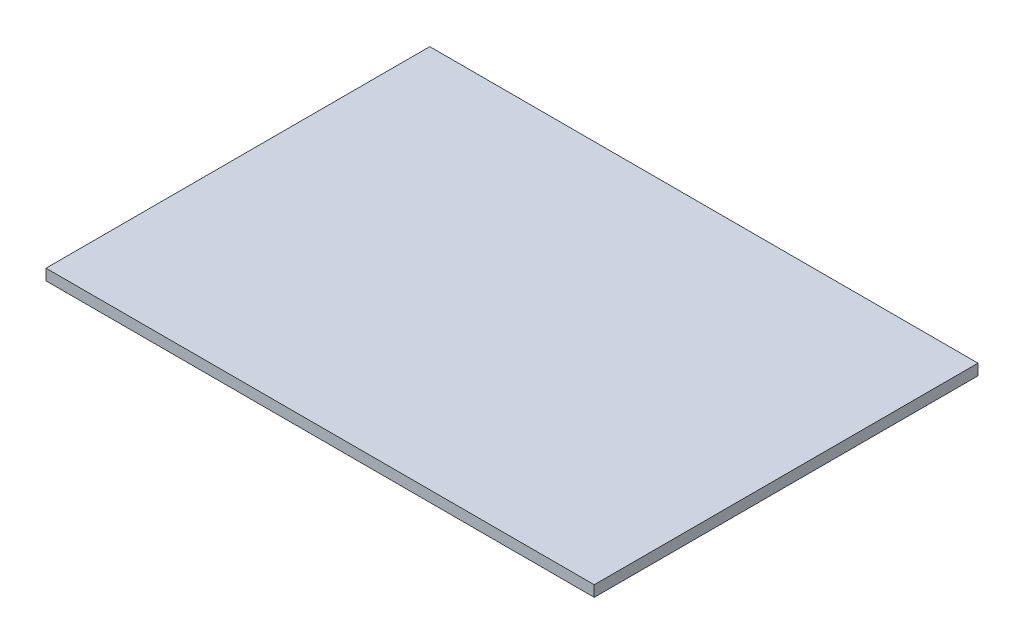
from build123d import *

# Parameters (mm, degrees)
SKETCH1_W           = 500
SKETCH1_H           = 350
BOSS_EXTRUDE1_DEPTH = 10


with BuildPart() as part:
    # Sketch1 → Boss-Extrude1 (new body)
    with BuildSketch(Plane(origin=(0, 0, 0), x_dir=(1, 0, 0), z_dir=(0, 1, 0))):
        Rectangle(SKETCH1_W, SKETCH1_H)
    extrude(amount=BOSS_EXTRUDE1_DEPTH)


solid = part.part
